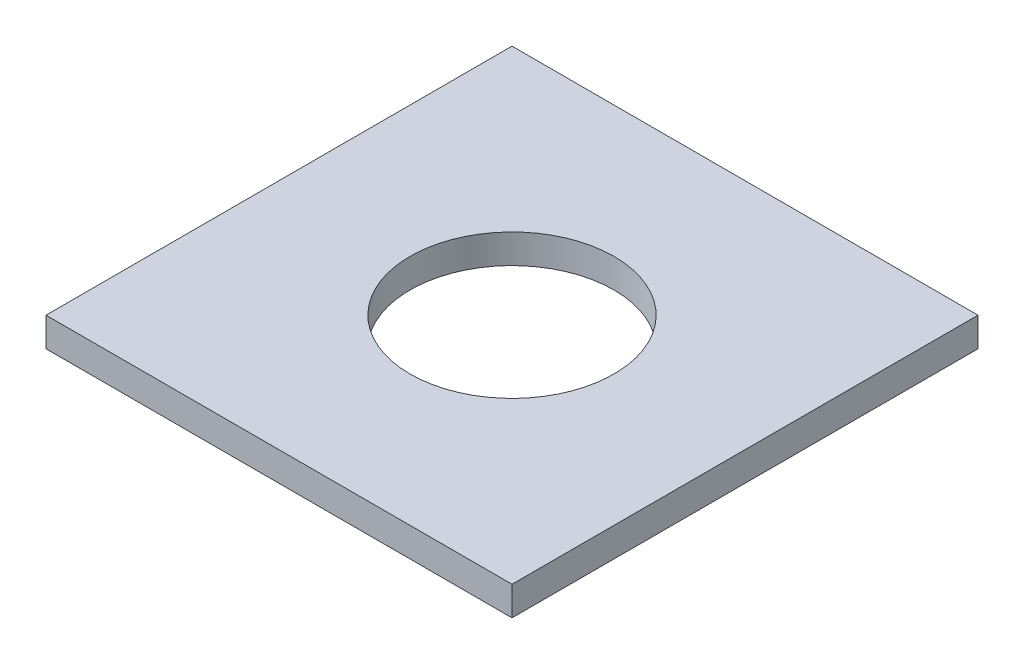
from build123d import *

# Parameters (mm, degrees)
SKETCH1_W           = 101.6
SKETCH1_H           = 101.6
SKETCH1_R           = 22.225
BOSS_EXTRUDE1_DEPTH = 6.35


with BuildPart() as part:
    # Sketch1 → Boss-Extrude1 (new body)
    with BuildSketch(Plane(origin=(0, 0, 0), x_dir=(1, 0, 0), z_dir=(0, 1, 0))):
        with Locations((50.8, 50.8)):
            Rectangle(SKETCH1_W, SKETCH1_H)
        with Locations(Location((50.8, 50.8, 0), (0, 0, 270))):
            Circle(SKETCH1_R, mode=Mode.SUBTRACT)
    extrude(amount=BOSS_EXTRUDE1_DEPTH)


solid = part.part
